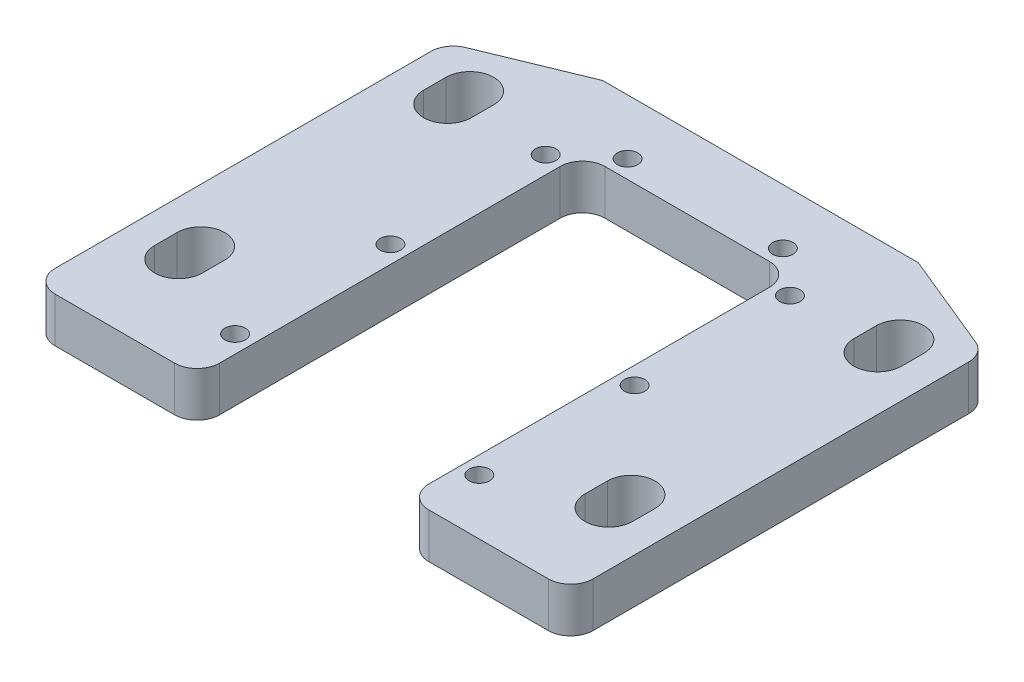
from build123d import *

# Parameters (mm, degrees)
SKETCH1_W              = 76.2
SKETCH1_H              = 76.2
BOSS_EXTRUDE1_DEPTH    = 3.175
SKETCH2_W              = 29.6545
SKETCH2_H              = 54.61
CUT_EXTRUDE1_DEPTH     = 55.254423783
M2_5_CLEARANCE_HOLE1_D = 2.9
CUT_EXTRUDE2_DEPTH     = 55.254423783
SKETCH9_W              = 76.2
SKETCH9_H              = 10.795
SKETCH9_H_2            = 0.41
CUT_EXTRUDE3_DEPTH     = 55.254423783
CUT_EXTRUDE4_DEPTH     = 54.967291946
FILLET1_R              = 3.175


with BuildPart() as part:
    # Sketch1 → Boss-Extrude1 (new, symmetric)
    with BuildSketch(Plane(origin=(0, 0, 0), x_dir=(1, 0, 0), z_dir=(0, 1, 0))):
        Rectangle(SKETCH1_W, SKETCH1_H)
    extrude(amount=BOSS_EXTRUDE1_DEPTH, both=True)

    # Sketch2 → Cut-Extrude1 (cut, through all)
    with BuildSketch(Plane(origin=(0, 3.175, 0), x_dir=(1, 0, 0), z_dir=(0, 1, 0))):
        Rectangle(SKETCH2_W, SKETCH2_H)
    extrude(amount=-CUT_EXTRUDE1_DEPTH, mode=Mode.SUBTRACT)

    # M2.5 Clearance Hole1 (through all)
    with Locations(Plane(origin=(0, 3.175, 0), x_dir=(1, 0, 0), z_dir=(0, 1, 0))):
        with Locations((-17.3, 24.551), (-11, 29.851), (-17.3, 2.551), (-17.3, -19.449)):
            m2_5_clearance_hole1 = Hole(M2_5_CLEARANCE_HOLE1_D / 2)

    # Sketch8 → Cut-Extrude2 (cut, through all)
    with BuildSketch(Plane(origin=(0, 3.175, 0), x_dir=(1, 0, 0), z_dir=(0, 1, 0))):
        with BuildLine():
            Line((-33.8582, -14.2875), (-33.8582, -11.1125))
            ThreePointArc((-33.8582, -11.1125), (-30.48, -7.7343), (-27.1018, -11.1125))
            Line((-27.1018, -11.1125), (-27.1018, -14.2875))
            ThreePointArc((-27.1018, -14.2875), (-30.48, -17.6657), (-33.8582, -14.2875))
        make_face()
        with BuildLine():
            Line((-33.8582, 23.8125), (-33.8582, 26.9875))
            ThreePointArc((-33.8582, 26.9875), (-30.48, 30.3657), (-27.1018, 26.9875))
            Line((-27.1018, 26.9875), (-27.1018, 23.8125))
            ThreePointArc((-27.1018, 23.8125), (-30.48, 20.4343), (-33.8582, 23.8125))
        make_face()
    cut_extrude2 = extrude(amount=-CUT_EXTRUDE2_DEPTH, mode=Mode.SUBTRACT)

    # Mirror1: M2.5 Clearance Hole1, Cut-Extrude2 across plane
    add(m2_5_clearance_hole1.mirror(Plane(origin=(0, 0, 0), x_dir=(0, 0, 1), z_dir=(1, 0, 0))), mode=Mode.SUBTRACT)
    add(cut_extrude2.mirror(Plane(origin=(0, 0, 0), x_dir=(0, 0, 1), z_dir=(1, 0, 0))), mode=Mode.SUBTRACT)

    # Sketch9 → Cut-Extrude3 (cut, through all)
    with BuildSketch(Plane(origin=(0, 3.175, 0), x_dir=(1, 0, 0), z_dir=(0, 1, 0))):
        with Locations((0, -32.7025)):
            Rectangle(SKETCH9_W, SKETCH9_H)
        with Locations((0, 37.895)):
            Rectangle(SKETCH9_W, SKETCH9_H_2)
    extrude(amount=-CUT_EXTRUDE3_DEPTH, mode=Mode.SUBTRACT)

    # Sketch13 → Cut-Extrude4 (cut, through all)
    with BuildSketch(Plane.XZ.offset(3.175)):
        Polygon((-38.1, -31.213), (-22.352, -37.69), (-38.1, -37.69), align=None)
    cut_extrude4 = extrude(amount=-CUT_EXTRUDE4_DEPTH, mode=Mode.SUBTRACT)

    # Mirror3: Cut-Extrude4 across plane
    add(cut_extrude4.mirror(Plane(origin=(0, 0, 0), x_dir=(0, 0, 1), z_dir=(1, 0, 0))), mode=Mode.SUBTRACT)

    # Fillet1
    fillet1_edges = [part.edges().sort_by_distance(p)[0] for p in [
        (-38.1, 0, 27.305),
        (38.1, 0, 27.305),
        (-38.1, 0, -31.213),
        (14.82725, 0, -27.305),
        (38.1, 0, -31.213),
        (14.82725, 0, 27.305),
        (-14.82725, 0, 27.305),
        (-14.82725, 0, -27.305),
    ]]
    fillet(fillet1_edges, radius=FILLET1_R)


solid = part.part
